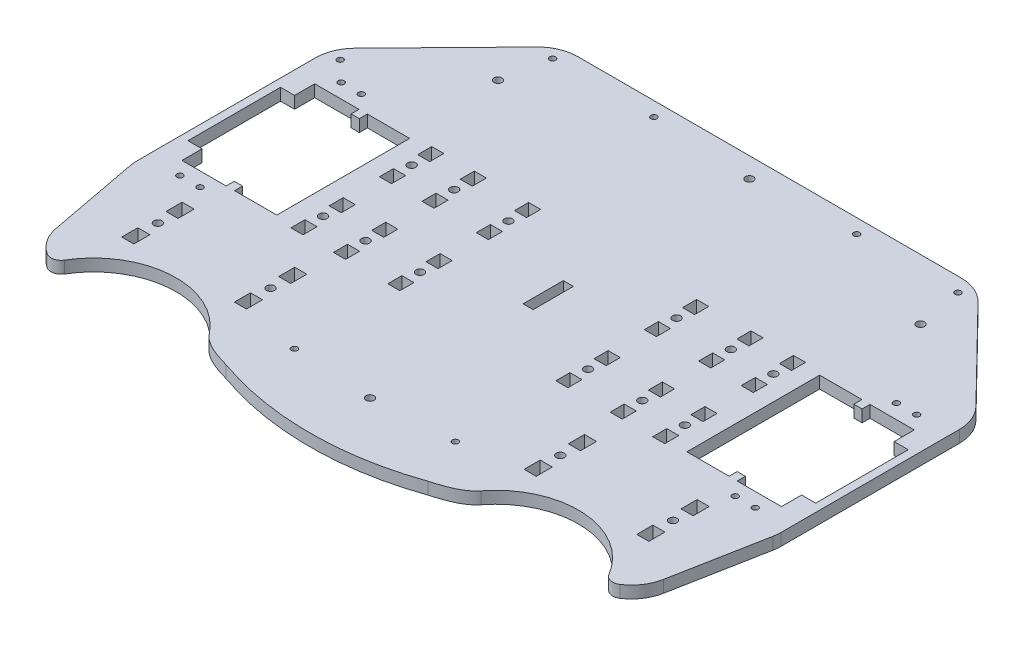
from build123d import *

# Parameters (mm, degrees)
BOSS_EXTRU_1_DEPTH      = 6
ENL_V_MAT_EXTRU_1_DEPTH = 6
CONG_1_R                = 5
ESQUISSE3_R             = 2
ESQUISSE3_W             = 6
ESQUISSE3_H             = 7
ESQUISSE3_W_2           = 5
ESQUISSE3_H_2           = 20
ESQUISSE3_W_3           = 21
ESQUISSE3_H_3           = 66
ENL_V_MAT_EXTRU_2_DEPTH = 6
ESQUISSE4_W             = 6
ESQUISSE4_H             = 8
ENL_V_MAT_EXTRU_3_DEPTH = 10
ESQUISSE5_R             = 2
ENL_V_MAT_EXTRU_4_DEPTH = 10
ESQUISSE6_R             = 2
ENL_V_MAT_EXTRU_5_DEPTH = 10
ESQUISSE7_R             = 2
ENL_V_MAT_EXTRU_6_DEPTH = 10
ESQUISSE9_R             = 2
ENL_V_MAT_EXTRU_8_DEPTH = 10
ESQUISSE8_R             = 1.5
ENL_V_MAT_EXTRU_7_DEPTH = 10


with BuildPart() as part:
    # Esquisse1 → Boss.-Extru.1 (new body)
    with BuildSketch(Plane(origin=(0, 0, 0), x_dir=(1, 0, 0), z_dir=(0, 1, 0))):
        with BuildLine():
            Line((-159.651418776, 61.996478628), (-151.00295557, 16.28223991))
            ThreePointArc((-151.00295557, 16.28223991), (-144.111724845, 4.599428553), (-131.351536794, 0))
            Line((-131.351536794, 0), (-50.176822125, 0))
            ThreePointArc((-50.176822125, 0), (0, -8.568957982), (50.176822125, 0))
            Line((50.176822125, 0), (131.351536794, 0))
            ThreePointArc((131.351536794, 0), (144.111724845, 4.599428553), (151.00295557, 16.28223991))
            Line((151.00295557, 16.28223991), (159.651418776, 61.996478628))
            ThreePointArc((159.651418776, 61.996478628), (159.912664005, 63.847205713), (160, 65.714238717))
            Line((160, 65.714238717), (160, 154.285761283))
            ThreePointArc((160, 154.285761283), (158.521020838, 161.833727042), (154.30282129, 168.265364394))
            Line((154.30282129, 168.265364394), (109.621642599, 213.979603112))
            ThreePointArc((109.621642599, 213.979603112), (103.077942966, 218.433557202), (95.31882131, 220))
            Line((95.31882131, 220), (-95.31882131, 220))
            ThreePointArc((-95.31882131, 220), (-103.077942966, 218.433557202), (-109.621642599, 213.979603112))
            Line((-109.621642599, 213.979603112), (-154.30282129, 168.265364394))
            ThreePointArc((-154.30282129, 168.265364394), (-158.521020838, 161.833727042), (-160, 154.285761283))
            Line((-160, 154.285761283), (-160, 65.714238717))
            ThreePointArc((-160, 65.714238717), (-159.912664005, 63.847205713), (-159.651418776, 61.996478628))
        make_face()
    extrude(amount=BOSS_EXTRU_1_DEPTH)

    # Esquisse2 → Enlèv. mat.-Extru.1 (cut)
    with BuildSketch(Plane(origin=(0, 6, 0), x_dir=(1, 0, 0), z_dir=(0, 1, 0))):
        with BuildLine():
            Line((-50.176822125, 0), (-59.213621948, -20.179876246))
            ThreePointArc((-59.213621948, -20.179876246), (-139.432191662, -27.22952629), (-67.535006697, 9.04045147))
            add(Edge.make_bspline(
                [(-50.176822125, 0), (-51.874530599, 0.597272033), (-62.853049902, 2.970285516), (-67.535006697, 9.04045147)],
                knots=[0, 0, 0, 0, 1, 1, 1, 1], degree=3))
        make_face()
        with BuildLine():
            Line((50.176822125, 0), (59.213621948, -20.179876246))
            ThreePointArc((59.213621948, -20.179876246), (139.432191662, -27.22952629), (67.535006697, 9.04045147))
            add(Edge.make_bspline(
                [(50.176822125, 0), (51.874530599, 0.597272033), (62.853049902, 2.970285516), (67.535006697, 9.04045147)],
                knots=[0, 0, 0, 0, 1, 1, 1, 1], degree=3))
        make_face()
    extrude(amount=-ENL_V_MAT_EXTRU_1_DEPTH, mode=Mode.SUBTRACT)

    # Congé1
    cong_1_edges = [part.edges().sort_by_distance(p)[0] for p in [
        (137.346089413, 3, -0.919503704),
        (-137.346089413, 3, -0.919503704),
    ]]
    fillet(cong_1_edges, radius=CONG_1_R)

    # Esquisse3 → Enlèv. mat.-Extru.2 (cut)
    with BuildSketch(Plane(origin=(0, 6, 0), x_dir=(-1, 0, 0), z_dir=(0, 1, 0))):
        with Locations(Location((89.9, -132, 0), (0, 0, 90))):
            Circle(ESQUISSE3_R)
        with Locations(Location((89.9, -88, 0), (0, 0, 90))):
            Circle(ESQUISSE3_R)
        with Locations(Location((68.76, -88, 0), (0, 0, 90))):
            Circle(ESQUISSE3_R)
        with Locations(Location((68.76, -132, 0), (0, 0, 90))):
            Circle(ESQUISSE3_R)
        with Locations(Location((41.76, -132, 0), (0, 0, 90))):
            Circle(ESQUISSE3_R)
        with Locations(Location((41.76, -88, 0), (0, 0, 90))):
            Circle(ESQUISSE3_R)
        with Locations(Location((-41.76, -88, 0), (0, 0, 270))):
            Circle(ESQUISSE3_R)
        with Locations(Location((-68.76, -88, 0), (0, 0, 270))):
            Circle(ESQUISSE3_R)
        with Locations(Location((-89.9, -88, 0), (0, 0, 270))):
            Circle(ESQUISSE3_R)
        with Locations(Location((-41.76, -132, 0), (0, 0, 270))):
            Circle(ESQUISSE3_R)
        with Locations(Location((-68.76, -132, 0), (0, 0, 270))):
            Circle(ESQUISSE3_R)
        with Locations(Location((-89.9, -132, 0), (0, 0, 270))):
            Circle(ESQUISSE3_R)
        with Locations((89.9, -141.5)):
            Rectangle(ESQUISSE3_W, ESQUISSE3_H)
        with Locations((89.9, -122.5)):
            Rectangle(ESQUISSE3_W, ESQUISSE3_H)
        with Locations((89.9, -97.5)):
            Rectangle(ESQUISSE3_W, ESQUISSE3_H)
        with Locations((89.9, -78.5)):
            Rectangle(ESQUISSE3_W, ESQUISSE3_H)
        with Locations((68.76, -141.5)):
            Rectangle(ESQUISSE3_W, ESQUISSE3_H)
        with Locations((0, -110)):
            Rectangle(ESQUISSE3_W_2, ESQUISSE3_H_2)
        with Locations((68.76, -122.5)):
            Rectangle(ESQUISSE3_W, ESQUISSE3_H)
        with Locations((68.76, -97.5)):
            Rectangle(ESQUISSE3_W, ESQUISSE3_H)
        with Locations((68.76, -78.5)):
            Rectangle(ESQUISSE3_W, ESQUISSE3_H)
        with Locations((41.76, -141.5)):
            Rectangle(ESQUISSE3_W, ESQUISSE3_H)
        with Locations((41.76, -122.5)):
            Rectangle(ESQUISSE3_W, ESQUISSE3_H)
        with Locations((41.76, -97.5)):
            Rectangle(ESQUISSE3_W, ESQUISSE3_H)
        with Locations((41.76, -78.5)):
            Rectangle(ESQUISSE3_W, ESQUISSE3_H)
        with Locations((-41.76, -78.5)):
            Rectangle(ESQUISSE3_W, ESQUISSE3_H)
        with Locations((-41.76, -97.5)):
            Rectangle(ESQUISSE3_W, ESQUISSE3_H)
        with Locations((-68.76, -78.5)):
            Rectangle(ESQUISSE3_W, ESQUISSE3_H)
        with Locations((-68.76, -97.5)):
            Rectangle(ESQUISSE3_W, ESQUISSE3_H)
        with Locations((-89.9, -78.5)):
            Rectangle(ESQUISSE3_W, ESQUISSE3_H)
        with Locations((-89.9, -97.5)):
            Rectangle(ESQUISSE3_W, ESQUISSE3_H)
        with Locations((-41.76, -122.5)):
            Rectangle(ESQUISSE3_W, ESQUISSE3_H)
        with Locations((-68.76, -122.5)):
            Rectangle(ESQUISSE3_W, ESQUISSE3_H)
        with Locations((-89.9, -122.5)):
            Rectangle(ESQUISSE3_W, ESQUISSE3_H)
        with Locations((-41.76, -141.5)):
            Rectangle(ESQUISSE3_W, ESQUISSE3_H)
        with Locations((-68.76, -141.5)):
            Rectangle(ESQUISSE3_W, ESQUISSE3_H)
        with Locations((-89.9, -141.5)):
            Rectangle(ESQUISSE3_W, ESQUISSE3_H)
        with Locations((112.4, -110)):
            Rectangle(ESQUISSE3_W_3, ESQUISSE3_H_3)
        with Locations((-112.4, -110)):
            Rectangle(ESQUISSE3_W_3, ESQUISSE3_H_3)
    extrude(amount=-ENL_V_MAT_EXTRU_2_DEPTH, mode=Mode.SUBTRACT)

    # Esquisse4 → Enlèv. mat.-Extru.3 (cut)
    with BuildSketch(Plane(origin=(0, 6, 0), x_dir=(1, 0, 0), z_dir=(0, 1, 0))):
        with Locations((-128, 55)):
            Rectangle(ESQUISSE4_W, ESQUISSE4_H)
        with Locations((-128, 33)):
            Rectangle(ESQUISSE4_W, ESQUISSE4_H)
        with Locations((-72, 33)):
            Rectangle(ESQUISSE4_W, ESQUISSE4_H)
        with Locations((-72, 55)):
            Rectangle(ESQUISSE4_W, ESQUISSE4_H)
        with Locations((72, 55)):
            Rectangle(ESQUISSE4_W, ESQUISSE4_H)
        with Locations((72, 33)):
            Rectangle(ESQUISSE4_W, ESQUISSE4_H)
        with Locations((128, 33)):
            Rectangle(ESQUISSE4_W, ESQUISSE4_H)
        with Locations((128, 55)):
            Rectangle(ESQUISSE4_W, ESQUISSE4_H)
    extrude(amount=-ENL_V_MAT_EXTRU_3_DEPTH, mode=Mode.SUBTRACT)

    # Esquisse5 → Enlèv. mat.-Extru.4 (cut)
    with BuildSketch(Plane(origin=(0, 6, 0), x_dir=(1, 0, 0), z_dir=(0, 1, 0))):
        with Locations(Location((-105, 190, 0), (0, 0, 270))):
            Circle(ESQUISSE5_R)
        with Locations(Location((105, 190, 0), (0, 0, 270))):
            Circle(ESQUISSE5_R)
    extrude(amount=-ENL_V_MAT_EXTRU_4_DEPTH, mode=Mode.SUBTRACT)

    # Esquisse6 → Enlèv. mat.-Extru.5 (cut)
    with BuildSketch(Plane(origin=(0, 6, 0), x_dir=(1, 0, 0), z_dir=(0, 1, 0))):
        with Locations(Location((0, 210, 0), (0, 0, 270))):
            Circle(ESQUISSE6_R)
    extrude(amount=-ENL_V_MAT_EXTRU_5_DEPTH, mode=Mode.SUBTRACT)

    # Esquisse7 → Enlèv. mat.-Extru.6 (cut)
    with BuildSketch(Plane(origin=(0, 6, 0), x_dir=(-1, 0, 0), z_dir=(0, 1, 0))):
        with Locations(Location((0, -21.431042018, 0), (0, 0, 90))):
            Circle(ESQUISSE7_R)
    extrude(amount=-ENL_V_MAT_EXTRU_6_DEPTH, mode=Mode.SUBTRACT)

    # Esquisse9 → Enlèv. mat.-Extru.8 (cut)
    with BuildSketch(Plane(origin=(0, 6, 0), x_dir=(-1, 0, 0), z_dir=(0, 1, 0))):
        with Locations(Location((128, -44, 0), (0, 0, 90))):
            Circle(ESQUISSE9_R)
        with Locations(Location((72, -44, 0), (0, 0, 90))):
            Circle(ESQUISSE9_R)
        with Locations(Location((-72, -44, 0), (0, 0, 90))):
            Circle(ESQUISSE9_R)
        with Locations(Location((-128, -44, 0), (0, 0, 90))):
            Circle(ESQUISSE9_R)
    extrude(amount=-ENL_V_MAT_EXTRU_8_DEPTH, mode=Mode.SUBTRACT)

    # Esquisse8 → Enlèv. mat.-Extru.7 (cut)
    with BuildSketch(Plane(origin=(0, 6, 0), x_dir=(1, 0, 0), z_dir=(0, 1, 0))):
        with Locations(Location((-152.964714587, 159.569337314, 0), (0, 0, 270))):
            Circle(ESQUISSE8_R)
        with Locations(Location((-100.750206469, 212.903490041, 0), (0, 0, 270))):
            Circle(ESQUISSE8_R)
        with Locations(Location((-50.375103235, 212.903490041, 0), (0, 0, 270))):
            Circle(ESQUISSE8_R)
        with Locations(Location((50.375103235, 212.903490041, 0), (0, 0, 270))):
            Circle(ESQUISSE8_R)
        with Locations(Location((100.750206469, 212.903490041, 0), (0, 0, 270))):
            Circle(ESQUISSE8_R)
        with Locations(Location((-143, 69.925529543, 0), (0, 0, 270))):
            Circle(ESQUISSE8_R)
        with Locations(Location((-40, 23.831042018, 0), (0, 0, 270))):
            Circle(ESQUISSE8_R)
        with Locations(Location((40, 23.831042018, 0), (0, 0, 270))):
            Circle(ESQUISSE8_R)
        with Locations(Location((-133, 69.925529543, 0), (0, 0, 270))):
            Circle(ESQUISSE8_R)
        with Locations(Location((-133, 150.074470457, 0), (0, 0, 270))):
            Circle(ESQUISSE8_R)
        with Locations(Location((-143, 150.074470457, 0), (0, 0, 270))):
            Circle(ESQUISSE8_R)
        with Locations(Location((133, 69.925529543, 0), (0, 0, 270))):
            Circle(ESQUISSE8_R)
        with Locations(Location((143, 69.925529543, 0), (0, 0, 270))):
            Circle(ESQUISSE8_R)
        with Locations(Location((143, 150.074470457, 0), (0, 0, 270))):
            Circle(ESQUISSE8_R)
        with Locations(Location((133, 150.074470457, 0), (0, 0, 270))):
            Circle(ESQUISSE8_R)
        Polygon((-127, 142.925529543), (-149, 142.925529543), (-149, 132.925529543), (-156, 132.925529543), (-156, 86.925529543), (-149, 86.925529543), (-149, 76.925529543), (-127, 76.925529543), (-127, 81), (-122.9, 81), (-122.9, 139), (-127, 139), align=None)
        Polygon((127, 81), (127, 76.925529543), (149, 76.925529543), (149, 86.925529543), (156, 86.925529543), (156, 132.925529543), (149, 132.925529543), (149, 142.925529543), (127, 142.925529543), (127, 139), (122.9, 139), (122.9, 81), align=None)
    extrude(amount=-ENL_V_MAT_EXTRU_7_DEPTH, mode=Mode.SUBTRACT)


solid = part.part
